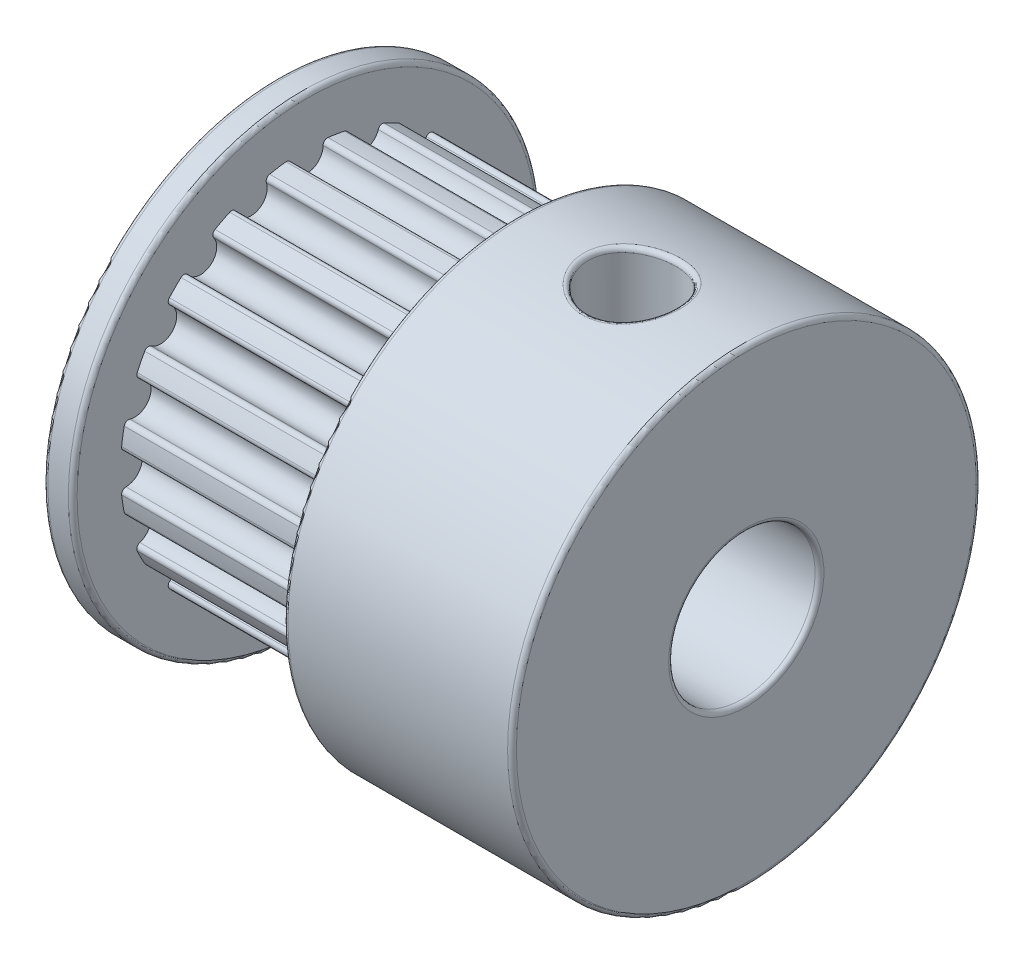
from build123d import *

# Parameters (mm, degrees)
CUT_EXTRUDE1_DEPTH       = 7.2
FILLET1_R                = 0.15
CIRPATTERN1_COUNT        = 20
FILLET1_OF_CIRPATTERN1_R = 0.15
FILLET2_R                = 0.15
SKETCH3_R                = 1.5
CUT_EXTRUDE2_DEPTH       = 7.2
FILLET3_R                = 0.15
FILLET4_R                = 0.15


with BuildPart() as part:
    # Sketch1 → Revolve1 (revolve)
    with BuildSketch(Plane.XY, mode=Mode.PRIVATE) as revolve1_sk:
        Polygon((0, 8), (1, 8), (1, 6.37), (8.2, 6.37), (8.2, 8), (16, 8), (16, 2.5), (0, 2.5), align=None)
    revolve(revolve1_sk.sketch.rotate(Axis((0, 0, 0), (1, 0, 0)), 90), axis=Axis((0, 0, 0), (1, 0, 0)))

    # Sketch2 → Cut-Extrude1 (cut)
    with BuildSketch(Plane.ZY.offset(-8.2)):
        with BuildLine():
            ThreePointArc((0.523570189, 6.348446602), (0, 6.37), (-0.523570189, 6.348446602))
            ThreePointArc((-0.523570189, 6.348446602), (0, 5.63), (0.523570189, 6.348446602))
        make_face()
    cut_extrude1 = extrude(amount=CUT_EXTRUDE1_DEPTH, mode=Mode.SUBTRACT)

    # Fillet1
    fillet1_edges = [part.edges().sort_by_distance(p)[0] for p in [
        (4.6, 6.348446602, -0.523570189),
        (4.6, 6.348446602, 0.523570189),
    ]]
    fillet(fillet1_edges, radius=FILLET1_R)

    # CirPattern1: Cut-Extrude1 ×20 about axis
    cirpattern1_axis = Axis((0, 0, 0), (1, 0, 0))
    for i in range(1, CIRPATTERN1_COUNT):
        add(cut_extrude1.rotate(cirpattern1_axis, i * 360 / CIRPATTERN1_COUNT), mode=Mode.SUBTRACT)

    # Fillet1 of CirPattern1
    fillet1_of_cirpattern1_edges = [part.edges().sort_by_distance(p)[0] for p in [
        (4.6, 6.199523595, 1.463833048),
        (4.6, 5.875939423, 2.459722727),
        (4.6, 5.443748024, 3.307946107),
        (4.6, 4.828254354, 4.155100468),
        (4.6, 4.155100468, 4.828254354),
        (4.6, 3.307946107, 5.443748024),
        (4.6, 2.459722727, 5.875939423),
        (4.6, 1.463833048, 6.199523595),
        (4.6, 0.523570189, 6.348446602),
        (4.6, -0.523570189, 6.348446602),
        (4.6, -1.463833048, 6.199523595),
        (4.6, -2.459722727, 5.875939423),
        (4.6, -3.307946107, 5.443748024),
        (4.6, -4.155100468, 4.828254354),
        (4.6, -4.828254354, 4.155100468),
        (4.6, -5.443748024, 3.307946107),
        (4.6, -5.875939423, 2.459722727),
        (4.6, -6.199523595, 1.463833048),
        (4.6, -6.348446602, 0.523570189),
        (4.6, -6.348446602, -0.523570189),
        (4.6, -6.199523595, -1.463833048),
        (4.6, -5.875939423, -2.459722727),
        (4.6, -5.443748024, -3.307946107),
        (4.6, -4.828254354, -4.155100468),
        (4.6, -4.155100468, -4.828254354),
        (4.6, -3.307946107, -5.443748024),
        (4.6, -2.459722727, -5.875939423),
        (4.6, -1.463833048, -6.199523595),
        (4.6, -0.523570189, -6.348446602),
        (4.6, 0.523570189, -6.348446602),
        (4.6, 1.463833048, -6.199523595),
        (4.6, 2.459722727, -5.875939423),
        (4.6, 3.307946107, -5.443748024),
        (4.6, 4.155100468, -4.828254354),
        (4.6, 4.828254354, -4.155100468),
        (4.6, 5.443748024, -3.307946107),
        (4.6, 5.875939423, -2.459722727),
        (4.6, 6.199523595, -1.463833048),
    ]]
    fillet(fillet1_of_cirpattern1_edges, radius=FILLET1_OF_CIRPATTERN1_R)

    # Fillet2
    fillet2_edges = [part.edges().sort_by_distance(p)[0] for p in [
        (0, 0, -8),
        (1, 0, -8),
        (8.2, 0, -8),
        (16, 0, -8),
        (0, 0, -2.5),
    ]]
    fillet(fillet2_edges, radius=FILLET2_R)

    # Sketch3 → Cut-Extrude2 (cut)
    with BuildSketch(Plane(origin=(0, 8, 0), x_dir=(1, 0, 0), z_dir=(0, 1, 0))):
        with Locations(Location((12.1, 0, 0), (0, 0, 270))):
            Circle(SKETCH3_R)
    extrude(amount=-CUT_EXTRUDE2_DEPTH, mode=Mode.SUBTRACT)

    # Fillet3
    fillet3_edges = [part.edges().sort_by_distance(p)[0] for p in [
        (12.100000003, 7.858116824, -1.500000004),
    ]]
    fillet(fillet3_edges, radius=FILLET3_R)

    # Fillet4
    fillet4_edges = [part.edges().sort_by_distance(p)[0] for p in [
        (16, 0, -2.5),
    ]]
    fillet(fillet4_edges, radius=FILLET4_R)


solid = part.part
